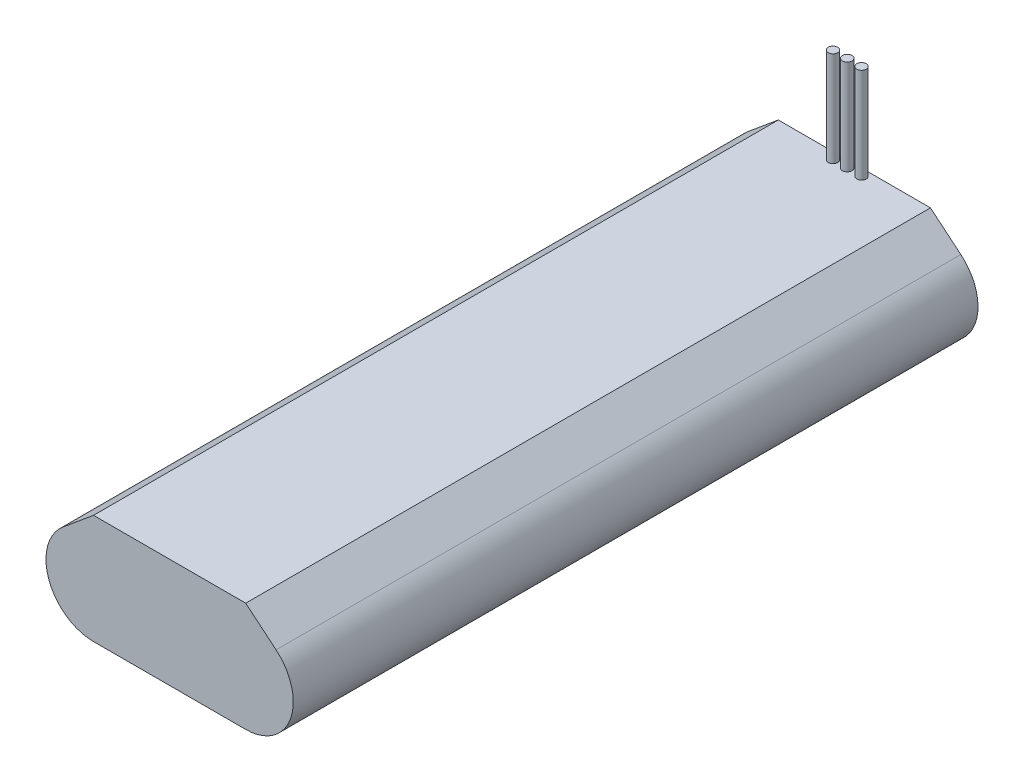
from build123d import *

# Parameters (mm, degrees)
EXTRUDE_1_DEPTH = 144
SKETCH_2_R      = 1
EXTRUDE_2_DEPTH = 20


with BuildPart() as part:
    # 스케치1 → 보스-돌출1 (new body)
    with BuildSketch(Plane.XY):
        with BuildLine():
            Line((-16, -10), (16, -10))
            ThreePointArc((16, -10), (25.405398904, -3.396832561), (22.38971305, 7.69230571))
            Line((22.38971305, 7.69230571), (16.000004032, 13))
            Line((16.000004032, 13), (-16, 13))
            Line((-16, 13), (-22.389710664, 7.692307692))
            ThreePointArc((-22.389710664, 7.692307692), (-25.405399431, -3.396831102), (-16, -10))
        make_face()
    extrude(amount=EXTRUDE_1_DEPTH)

    # 스케치2 → 보스-돌출2 (add)
    with BuildSketch(Plane(origin=(0, 13, 0), x_dir=(1, 0, 0), z_dir=(0, 1, 0))):
        with Locations(Location((-3, -1.5, 0), (0, 0, 90))):
            Circle(SKETCH_2_R)
        with Locations(Location((0, -1.5, 0), (0, 0, 90))):
            Circle(SKETCH_2_R)
        with Locations(Location((3, -1.5, 0), (0, 0, 90))):
            Circle(SKETCH_2_R)
    extrude(amount=EXTRUDE_2_DEPTH)


solid = part.part
